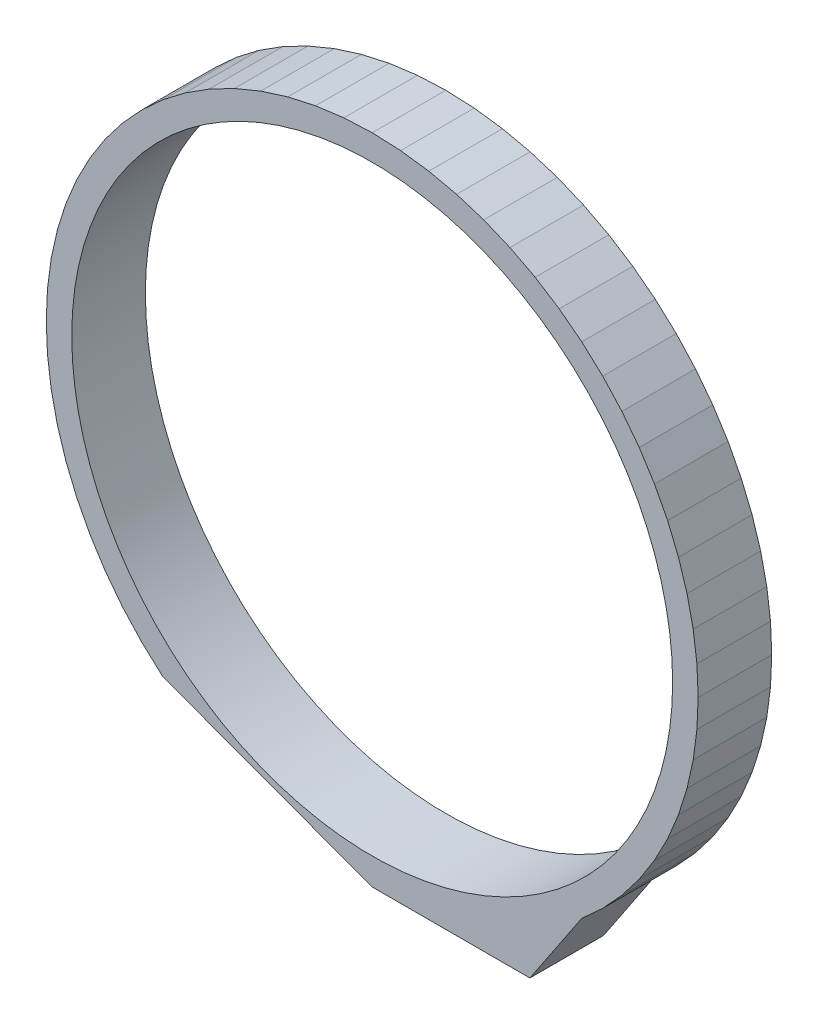
from build123d import *

# Parameters (mm, degrees)
CLAMP_AND_LOWER_FOOT_DEPTH = 14
SKETCH_2_R                 = 57.15
CANISTER_SEAT_DEPTH        = 89.959640287


with BuildPart() as part:
    # 草图1 → Clamp_and_lower_foot (new body)
    with BuildSketch(Plane.XY):
        Polygon((39.852831801, -47.494755473), (43.840620434, -43.840620434), (47.494755473, -39.852831801), (50.787426746, -35.561739054), (53.693575035, -31), (56.191082796, -26.202332228), (58.260942489, -21.205248886), (59.88740123, -16.046780796), (61.058080687, -10.766187015), (61.764071282, -5.40365605), (62, 0), (61.764071282, 5.40365605), (61.058080687, 10.766187015), (59.88740123, 16.046780796), (58.260942489, 21.205248886), (56.191082796, 26.202332228), (53.693575035, 31), (50.787426746, 35.561739054), (47.494755473, 39.852831801), (43.840620434, 43.840620434), (39.852831801, 47.494755473), (35.561739054, 50.787426746), (31, 53.693575035), (26.202332228, 56.191082796), (21.205248886, 58.260942489), (16.046780796, 59.88740123), (10.766187015, 61.058080687), (5.40365605, 61.764071282), (0, 62), (-5.40365605, 61.764071282), (-10.766187015, 61.058080687), (-16.046780796, 59.88740123), (-21.205248886, 58.260942489), (-26.202332228, 56.191082796), (-31, 53.693575035), (-35.561739054, 50.787426746), (-39.852831801, 47.494755473), (-43.840620434, 43.840620434), (-47.494755473, 39.852831801), (-50.787426746, 35.561739054), (-53.693575035, 31), (-56.191082796, 26.202332228), (-58.260942489, 21.205248886), (-59.88740123, 16.046780796), (-61.058080687, 10.766187015), (-61.764071282, 5.40365605), (-62, 0), (-61.764071282, -5.40365605), (-61.058080687, -10.766187015), (-59.88740123, -16.046780796), (-58.260942489, -21.205248886), (-56.191082796, -26.202332228), (-53.693575035, -31), (-50.787426746, -35.561739054), (-47.494755473, -39.852831801), (-43.840620434, -43.840620434), (-39.852831801, -47.494755473), (-0.0065, -62.24), (29.9935, -62.24), align=None)
    extrude(amount=CLAMP_AND_LOWER_FOOT_DEPTH)

    # 草图2 → Canister_seat (cut, through all)
    with BuildSketch(Plane.XY.offset(14)):
        Circle(SKETCH_2_R)
    extrude(amount=-CANISTER_SEAT_DEPTH, mode=Mode.SUBTRACT)


solid = part.part
